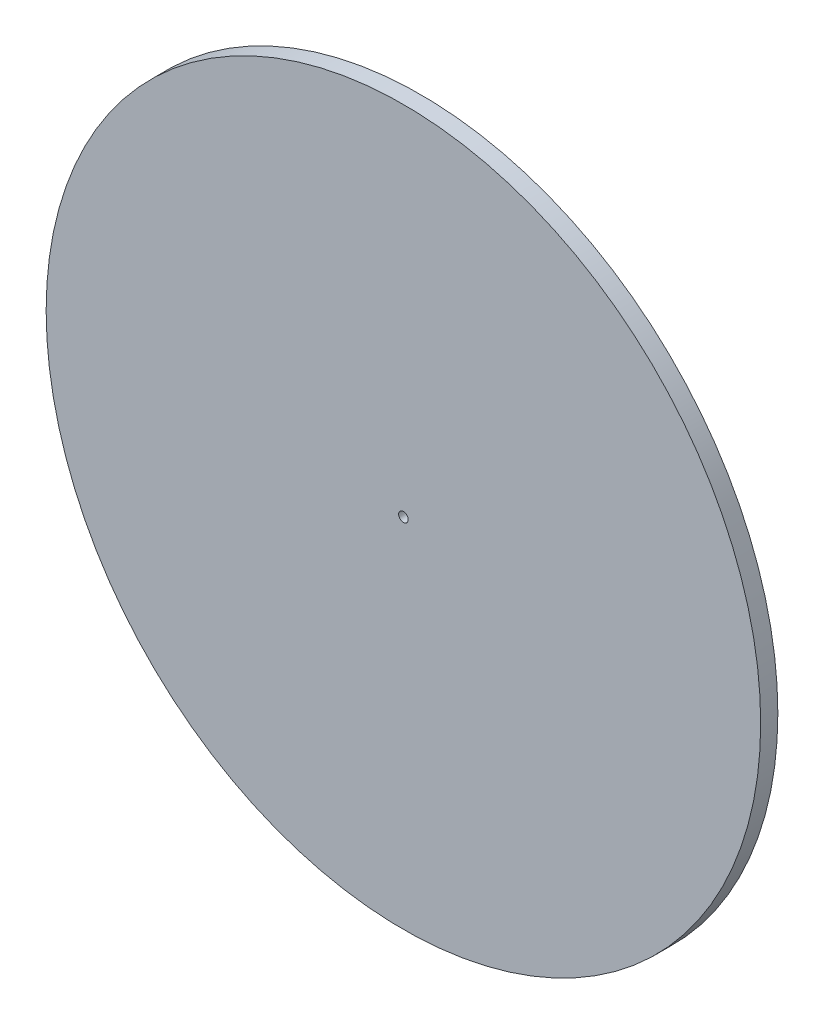
from build123d import *

# Parameters (mm, degrees)
SKETCH1_R           = 750
SKETCH1_R_2         = 10
BOSS_EXTRUDE1_DEPTH = 18


with BuildPart() as part:
    # Sketch1 → Boss-Extrude1 (new, symmetric)
    with BuildSketch(Plane.XY):
        Circle(SKETCH1_R)
        Circle(SKETCH1_R_2, mode=Mode.SUBTRACT)
    extrude(amount=BOSS_EXTRUDE1_DEPTH, both=True)


solid = part.part
